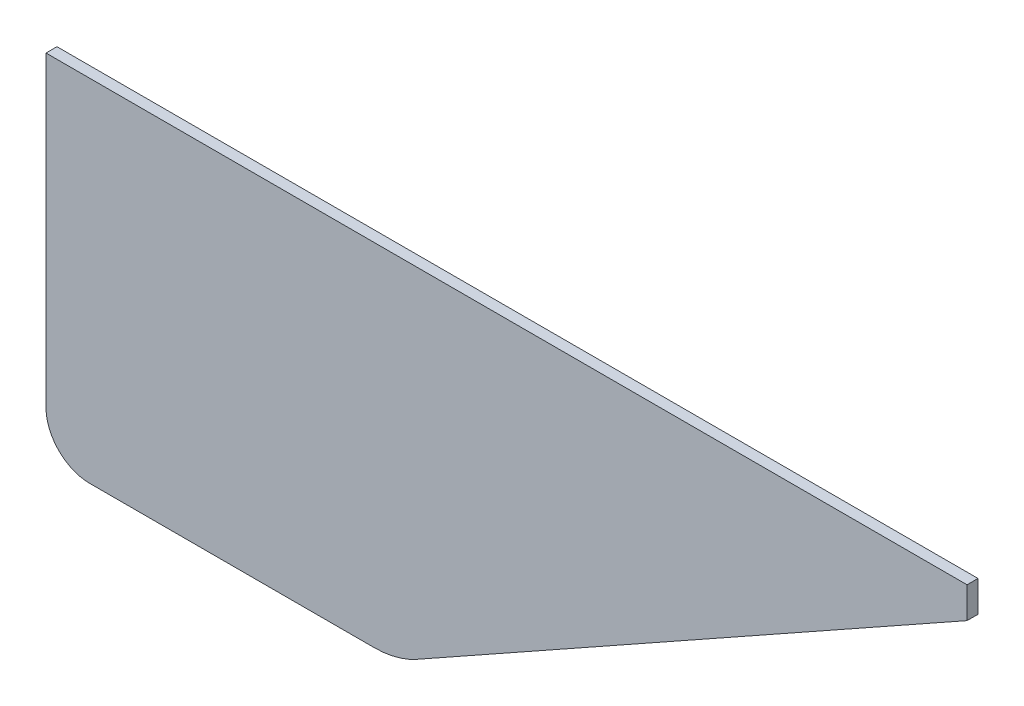
from build123d import *

# Parameters (mm, degrees)
BOSS_EXTRUDE1_DEPTH = 0.79375
FILLET1_R           = 6.35
FILLET2_R           = 12.7


with BuildPart() as part:
    # Sketch1 → Boss-Extrude1 (new, symmetric)
    with BuildSketch(Plane.XY):
        Polygon((0, 0), (-133.35, 0), (-133.35, -50.8), (-82.55, -50.8), (0, -4.5), align=None)
    extrude(amount=BOSS_EXTRUDE1_DEPTH, both=True)

    # Fillet1
    fillet1_edges = [part.edges().sort_by_distance(p)[0] for p in [
        (-133.35, -50.8, 0),
    ]]
    fillet(fillet1_edges, radius=FILLET1_R)

    # Fillet2
    fillet2_edges = [part.edges().sort_by_distance(p)[0] for p in [
        (-82.55, -50.8, 0),
    ]]
    fillet(fillet2_edges, radius=FILLET2_R)


solid = part.part
